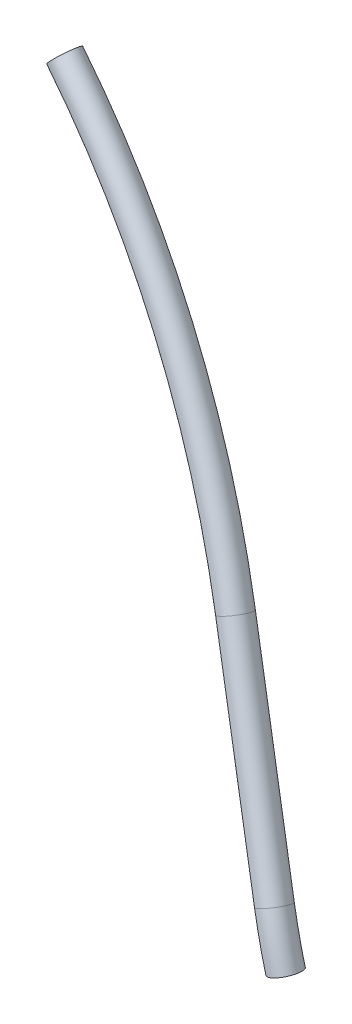
from build123d import *

# Parameters (mm, degrees)
SKETCH5_R = 50.8
SKETCH6_R = 50.8


with BuildPart() as part:
    # Sweep1: sweep along a path in Sketch3
    with BuildLine(Plane(origin=(10442.58259485, 3818.778538543, -4132.405152794), x_dir=(0.32718199478705784, 0.11964813958057499, 0.9373559969307654), z_dir=(-0.8803380864870314, -0.3219334068754298, 0.3483729826176695))) as sweep1_path:
        ThreePointArc((-12875.950426723, -2455.059223009), (-12888.405580863, -2368.689263182), (-12906.729140686, -2283.371340208))
    # Sketch5 → Sweep1 (sweep)
    with BuildSketch(Plane(origin=(391.760604273, -956.569089723, 106.007746304), x_dir=(-0.9262061454455515, -0.3747234604681671, 0.04152715152350278), z_dir=(-0.3770174745802825, 0.9205705181560061, -0.10201835601051586))):
        with Locations((-7213.54421214, -16106.204697762)):
            Circle(SKETCH5_R)
    sweep(path=sweep1_path.line)

    # Sweep2: sweep along a path in Sketch4
    with BuildLine(Plane(origin=(-2318.167615402, -4447.147056092, -13003.297522566), x_dir=(-0.9860695940920446, 0.05382576017155449, 0.15738342717422527), z_dir=(-0.1663332666877403, -0.31909189498036233, -0.9330131869115391))) as sweep2_path:
        Line((-9453.814527185, 5375.261975522), (-9138.819780398, 6058.751737353))
        ThreePointArc((-9138.819780398, 6058.751737353), (-8763.227306898, 6697.151127519), (-8268.34909733, 7248.258236172))
    # Sketch6 → Sweep2 (sweep)
    with BuildSketch(Plane(origin=(-381.709964746, 815.594616428, -210.885086179), x_dir=(-0.9108574837603319, -0.3995797633708689, 0.10331823160641518), z_dir=(-0.412721024758404, 0.8818555368427983, -0.22801791127469145))):
        with Locations((-8108.480159155, -15681.262539265)):
            Circle(SKETCH6_R)
    sweep(path=sweep2_path.line)


solid = part.part
